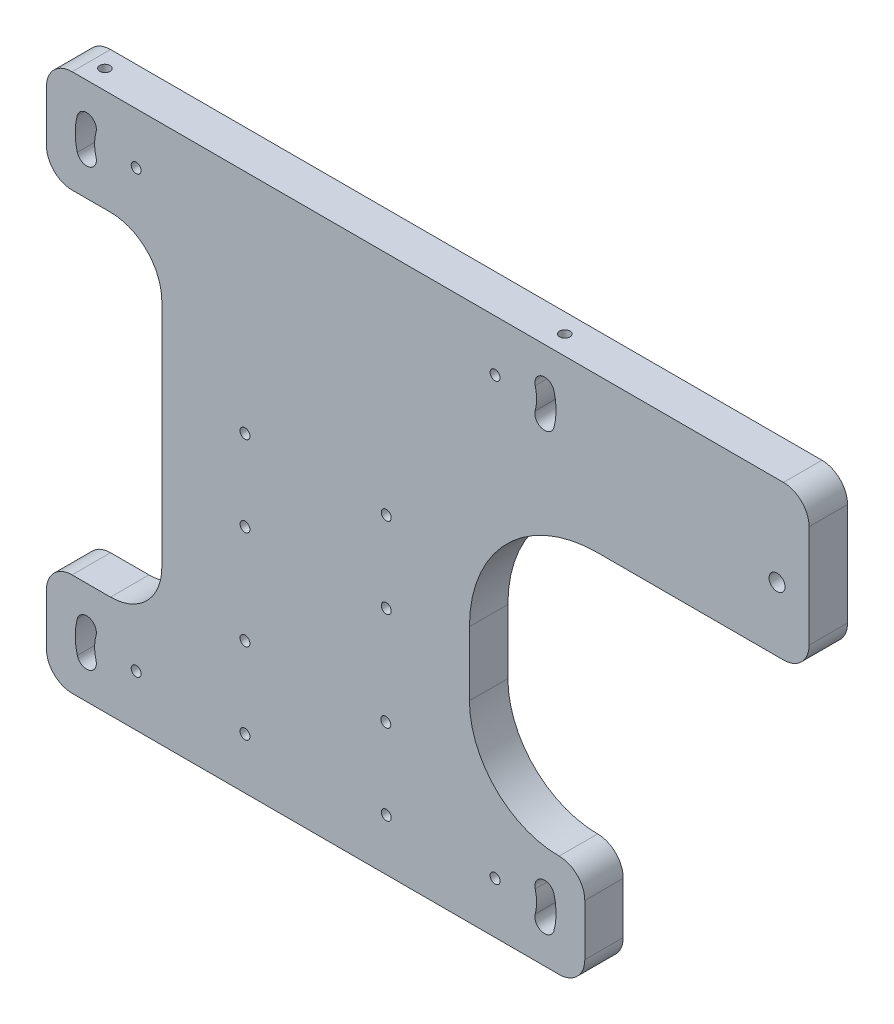
from build123d import *

# Parameters (mm, degrees)
MODEL_R             = 2.45745
MODEL_R_2           = 3.96875
BOSS_EXTRUDE1_DEPTH = 19.05
CUT_EXTRUDE1_REACH  = 843.816
SKETCH2_R           = 2.5527
CUT_EXTRUDE2_REACH  = 843.816
SKETCH4_R           = 2.5527


with BuildPart() as part:
    # Model → Boss-Extrude1 (new body)
    with BuildSketch(Plane.XY):
        with BuildLine():
            Line((785.524844282, 413.072749717), (433.09984428, 413.072749717))
            ThreePointArc((433.09984428, 413.072749717), (424.119588159, 409.353005838), (420.39984428, 400.372749717))
            Line((420.39984428, 400.372749717), (420.39984428, 374.972749717))
            ThreePointArc((420.39984428, 374.972749717), (424.119588159, 365.992493596), (433.09984428, 362.272749717))
            Line((433.09984428, 362.272749717), (452.14984428, 362.272749717))
            ThreePointArc((452.14984428, 362.272749717), (470.110356522, 354.833261959), (477.54984428, 336.872749717))
            Line((477.54984428, 336.872749717), (477.54984428, 222.572749717))
            ThreePointArc((477.54984428, 222.572749717), (470.110356522, 204.612237475), (452.14984428, 197.172749717))
            Line((452.14984428, 197.172749717), (433.09984428, 197.172749717))
            ThreePointArc((433.09984428, 197.172749717), (424.119588159, 193.453005838), (420.39984428, 184.472749717))
            Line((420.39984428, 184.472749717), (420.39984428, 159.072749717))
            ThreePointArc((420.39984428, 159.072749717), (424.119588159, 150.092493596), (433.09984428, 146.372749717))
            Line((433.09984428, 146.372749717), (674.399844282, 146.372749717))
            ThreePointArc((674.399844282, 146.372749717), (683.380100403, 150.092493596), (687.099844282, 159.072749717))
            Line((687.099844282, 159.072749717), (687.099844282, 184.472749717))
            ThreePointArc((687.099844282, 184.472749717), (683.380100403, 193.453005838), (674.399844282, 197.172749717))
            ThreePointArc((674.399844282, 197.172749717), (642.968947858, 210.191853293), (629.949844282, 241.622749717))
            Line((629.949844282, 241.622749717), (629.949844282, 273.372749717))
            ThreePointArc((629.949844282, 273.372749717), (648.548563677, 318.274030322), (693.449844282, 336.872749717))
            Line((693.449844282, 336.872749717), (785.524844282, 336.872749717))
            ThreePointArc((785.524844282, 336.872749717), (794.505100403, 340.592493596), (798.224844282, 349.572749717))
            Line((798.224844282, 349.572749717), (798.224844282, 400.372749717))
            ThreePointArc((798.224844282, 400.372749717), (794.505100403, 409.353005838), (785.524844282, 413.072749717))
        make_face()
        with Locations(Location((518.749844327, 171.772749712, 0), (0, 0, 180))):
            Circle(MODEL_R, mode=Mode.SUBTRACT)
        with Locations(Location((588.526419084, 211.772749722, 0), (0, 0, 180))):
            Circle(MODEL_R, mode=Mode.SUBTRACT)
        with Locations(Location((518.749844281, 260.672749712, 0), (0, 0, 180))):
            Circle(MODEL_R, mode=Mode.SUBTRACT)
        with Locations(Location((588.749844281, 300.672749722, 0), (0, 0, 180))):
            Circle(MODEL_R, mode=Mode.SUBTRACT)
        with Locations(Location((782.349844282, 368.616847103, 0), (0, 0, 180))):
            Circle(MODEL_R_2, mode=Mode.SUBTRACT)
        with Locations(Location((642.649844285, 171.772749717, 0), (0, 0, 180))):
            Circle(MODEL_R, mode=Mode.SUBTRACT)
        with Locations(Location((464.849844282, 171.772749717, 0), (0, 0, 180))):
            Circle(MODEL_R, mode=Mode.SUBTRACT)
        with Locations(Location((464.849844282, 387.672749714, 0), (0, 0, 180))):
            Circle(MODEL_R, mode=Mode.SUBTRACT)
        with Locations(Location((642.649844282, 387.672749714, 0), (0, 0, 180))):
            Circle(MODEL_R, mode=Mode.SUBTRACT)
        with Locations(Location((518.749844281, 300.672749722, 0), (0, 0, 180))):
            Circle(MODEL_R, mode=Mode.SUBTRACT)
        with Locations(Location((588.749844281, 260.672749712, 0), (0, 0, 180))):
            Circle(MODEL_R, mode=Mode.SUBTRACT)
        with Locations(Location((518.749844327, 211.772749722, 0), (0, 0, 180))):
            Circle(MODEL_R, mode=Mode.SUBTRACT)
        with Locations(Location((588.749844281, 171.996174909, 0), (0, 0, 180))):
            Circle(MODEL_R, mode=Mode.SUBTRACT)
        with BuildLine():
            ThreePointArc((444.9702071, 177.167541541), (444.259969282, 171.772749717), (444.9702071, 166.377957893))
            ThreePointArc((444.9702071, 166.377957893), (441.568935094, 160.486781969), (435.677759169, 163.888053974))
            ThreePointArc((435.677759169, 163.888053974), (434.639719282, 171.772749717), (435.677759169, 179.657445459))
            ThreePointArc((435.677759169, 179.657445459), (441.568935094, 183.058717465), (444.9702071, 177.167541541))
        make_face(mode=Mode.SUBTRACT)
        with BuildLine():
            ThreePointArc((671.821929397, 163.888053974), (672.859969285, 171.772749717), (671.821929397, 179.657445459))
            ThreePointArc((671.821929397, 179.657445459), (665.930753473, 183.058717465), (662.529481467, 177.167541541))
            ThreePointArc((662.529481467, 177.167541541), (663.239719285, 171.772749717), (662.529481467, 166.377957893))
            ThreePointArc((662.529481467, 166.377957893), (665.930753473, 160.486781969), (671.821929397, 163.888053974))
        make_face(mode=Mode.SUBTRACT)
        with BuildLine():
            ThreePointArc((671.821929395, 379.788053972), (672.859969282, 387.672749714), (671.821929395, 395.557445457))
            ThreePointArc((671.821929395, 395.557445457), (665.93075347, 398.958717463), (662.529481465, 393.067541538))
            ThreePointArc((662.529481465, 393.067541538), (663.239719282, 387.672749714), (662.529481465, 382.277957891))
            ThreePointArc((662.529481465, 382.277957891), (665.93075347, 376.386781966), (671.821929395, 379.788053972))
        make_face(mode=Mode.SUBTRACT)
        with BuildLine():
            ThreePointArc((444.9702071, 393.067541538), (444.259969282, 387.672749714), (444.9702071, 382.277957891))
            ThreePointArc((444.9702071, 382.277957891), (441.568935094, 376.386781966), (435.677759169, 379.788053972))
            ThreePointArc((435.677759169, 379.788053972), (434.639719282, 387.672749714), (435.677759169, 395.557445457))
            ThreePointArc((435.677759169, 395.557445457), (441.568935094, 398.958717463), (444.9702071, 393.067541538))
        make_face(mode=Mode.SUBTRACT)
    extrude(amount=BOSS_EXTRUDE1_DEPTH)

    # Sketch2 → Cut-Extrude1 (cut, up to next)
    with BuildSketch(Plane.XZ.offset(-146.372749717), mode=Mode.PRIVATE) as cut_extrude1_sk1:
        with Locations(Location((439.83084428, 9.525, 0), (0, 0, 270))):
            Circle(SKETCH2_R)
    cut_extrude1_tool1 = extrude(cut_extrude1_sk1.sketch, amount=-CUT_EXTRUDE1_REACH, mode=Mode.PRIVATE) & part.part
    # Sketch2 → Cut-Extrude1 (cut, up to next)
    with BuildSketch(Plane.XZ.offset(-146.372749717), mode=Mode.PRIVATE) as cut_extrude1_sk2:
        with Locations(Location((667.668844282, 9.525, 0), (0, 0, 270))):
            Circle(SKETCH2_R)
    cut_extrude1_tool2 = extrude(cut_extrude1_sk2.sketch, amount=-CUT_EXTRUDE1_REACH, mode=Mode.PRIVATE) & part.part
    add(cut_extrude1_tool1.solids().sort_by_distance((439.830844, 146.37275, 9.525))[0], mode=Mode.SUBTRACT)
    add(cut_extrude1_tool2.solids().sort_by_distance((667.668844, 146.37275, 9.525))[0], mode=Mode.SUBTRACT)

    # Sketch4 → Cut-Extrude2 (cut, up to next)
    with BuildSketch(Plane(origin=(0, 413.072749717, 0), x_dir=(1, 0, 0), z_dir=(0, 1, 0)), mode=Mode.PRIVATE) as cut_extrude2_sk1:
        with Locations(Location((439.83084428, -9.525, 0), (0, 0, 90))):
            Circle(SKETCH4_R)
    cut_extrude2_tool1 = extrude(cut_extrude2_sk1.sketch, amount=-CUT_EXTRUDE2_REACH, mode=Mode.PRIVATE) & part.part
    # Sketch4 → Cut-Extrude2 (cut, up to next)
    with BuildSketch(Plane(origin=(0, 413.072749717, 0), x_dir=(1, 0, 0), z_dir=(0, 1, 0)), mode=Mode.PRIVATE) as cut_extrude2_sk2:
        with Locations(Location((667.668844282, -9.525, 0), (0, 0, 90))):
            Circle(SKETCH4_R)
    cut_extrude2_tool2 = extrude(cut_extrude2_sk2.sketch, amount=-CUT_EXTRUDE2_REACH, mode=Mode.PRIVATE) & part.part
    add(cut_extrude2_tool1.solids().sort_by_distance((439.830844, 413.07275, 9.525))[0], mode=Mode.SUBTRACT)
    add(cut_extrude2_tool2.solids().sort_by_distance((667.668844, 413.07275, 9.525))[0], mode=Mode.SUBTRACT)


solid = part.part
